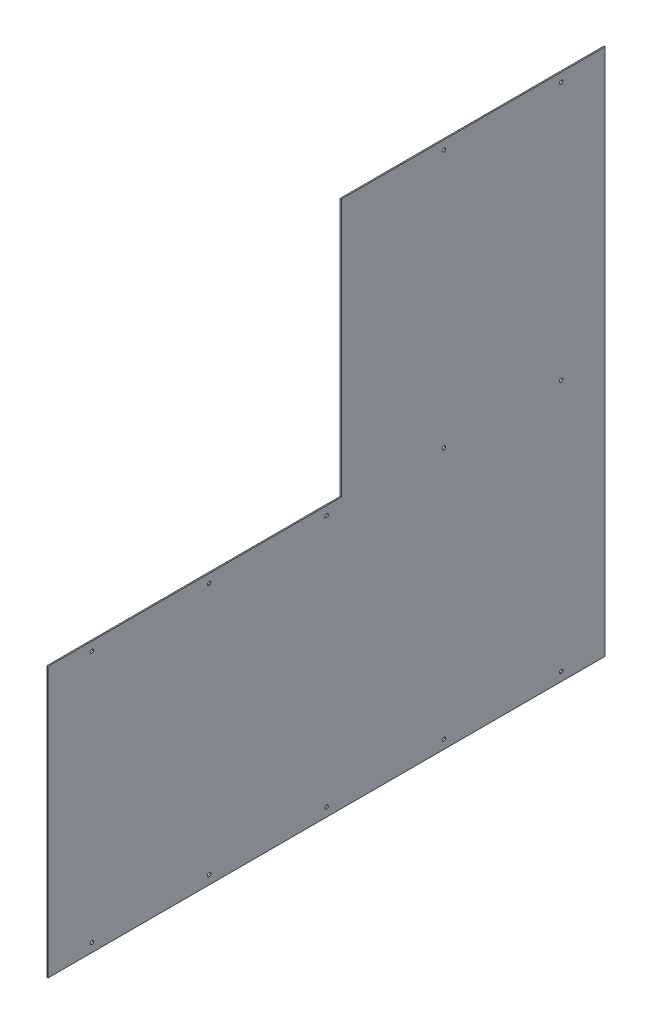
from build123d import *

# Parameters (mm, degrees)
SKETCH1_W           = 950
SKETCH1_H           = 460
BOSS_EXTRUDE2_DEPTH = 2
SKETCH3_R           = 3
CUT_EXTRUDE1_DEPTH  = 2
SKETCH5_W           = 450
SKETCH5_H           = 440
SKETCH5_R           = 3
BOSS_EXTRUDE3_DEPTH = 2


with BuildPart() as part:
    # Sketch1 → Boss-Extrude2 (new body)
    with BuildSketch(Plane(origin=(0, 0, 0), x_dir=(0, 0, -1), z_dir=(1, 0, 0))):
        Rectangle(SKETCH1_W, SKETCH1_H)
    extrude(amount=BOSS_EXTRUDE2_DEPTH)

    # Sketch3 → Cut-Extrude1 (cut)
    with BuildSketch(Plane(origin=(2, 0, 0), x_dir=(0, 0, -1), z_dir=(1, 0, 0))):
        with Locations((-400, 215)):
            Circle(SKETCH3_R)
        with Locations((-200, 215)):
            Circle(SKETCH3_R)
        with Locations((0, 215)):
            Circle(SKETCH3_R)
        with Locations((200, 215)):
            Circle(SKETCH3_R)
        with Locations((400, 215)):
            Circle(SKETCH3_R)
        with Locations(Location((400, -215, 0), (0, 0, 180))):
            Circle(SKETCH3_R)
        with Locations(Location((0, -215, 0), (0, 0, 180))):
            Circle(SKETCH3_R)
        with Locations(Location((200, -215, 0), (0, 0, 180))):
            Circle(SKETCH3_R)
        with Locations(Location((-200, -215, 0), (0, 0, 180))):
            Circle(SKETCH3_R)
        with Locations(Location((-400, -215, 0), (0, 0, 180))):
            Circle(SKETCH3_R)
    extrude(amount=-CUT_EXTRUDE1_DEPTH, mode=Mode.SUBTRACT)

    # Sketch5 → Boss-Extrude3 (add)
    with BuildSketch(Plane(origin=(2, 0, 0), x_dir=(0, 0, -1), z_dir=(1, 0, 0))):
        with Locations((250, 450)):
            Rectangle(SKETCH5_W, SKETCH5_H)
        with Locations((400, 655)):
            Circle(SKETCH5_R, mode=Mode.SUBTRACT)
        with Locations((200, 655)):
            Circle(SKETCH5_R, mode=Mode.SUBTRACT)
    extrude(amount=-BOSS_EXTRUDE3_DEPTH)


solid = part.part
